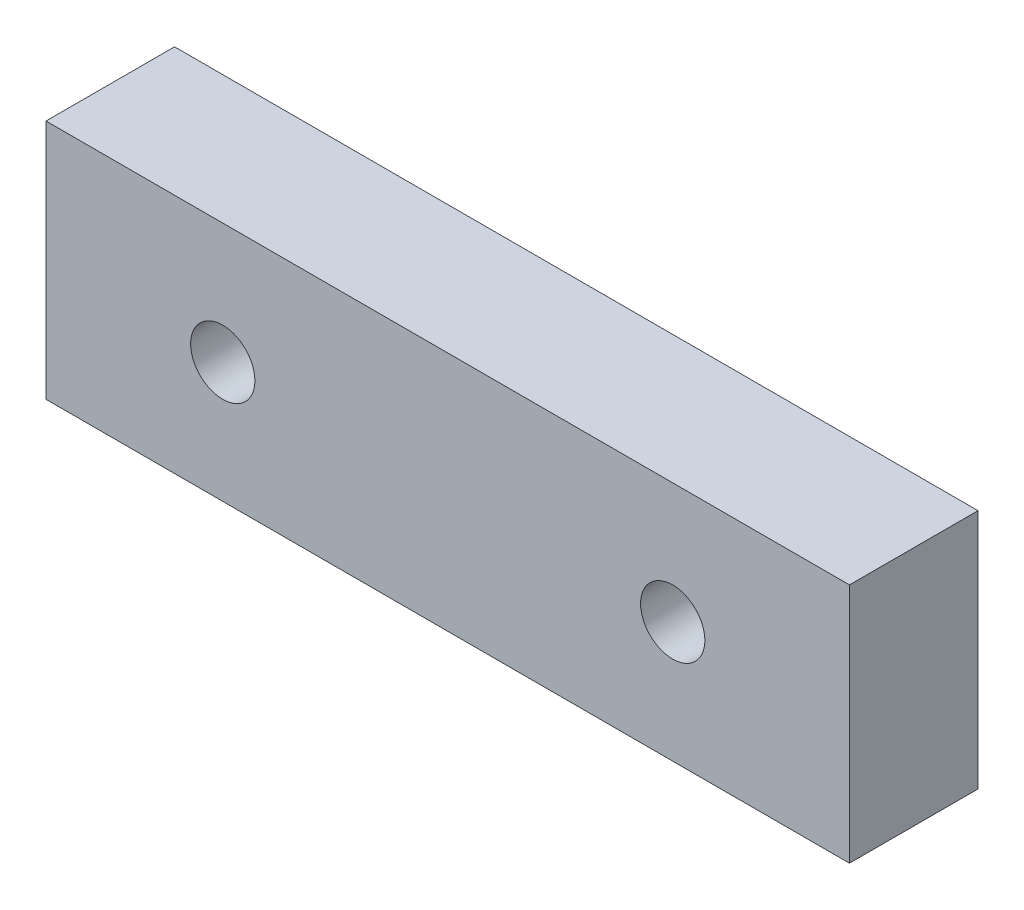
from build123d import *

# Parameters (mm, degrees)
SKETCH_1_W          = 50
SKETCH_1_H          = 15
EXTRUDE_1_DEPTH     = 8
SKETCH_2_R          = 2
CUT_EXTRUDE_1_DEPTH = 28.299267389


with BuildPart() as part:
    # 草图1 → 凸台-拉伸1 (new body)
    with BuildSketch(Plane.XY):
        Rectangle(SKETCH_1_W, SKETCH_1_H)
    extrude(amount=EXTRUDE_1_DEPTH)

    # 草图2 → 切除-拉伸1 (cut, through all)
    with BuildSketch(Plane.XY.offset(8)):
        with Locations((-14, 0)):
            Circle(SKETCH_2_R)
        with Locations(Location((14, 0, 0), (0, 0, 180))):
            Circle(SKETCH_2_R)
    extrude(amount=-CUT_EXTRUDE_1_DEPTH, mode=Mode.SUBTRACT)


solid = part.part
